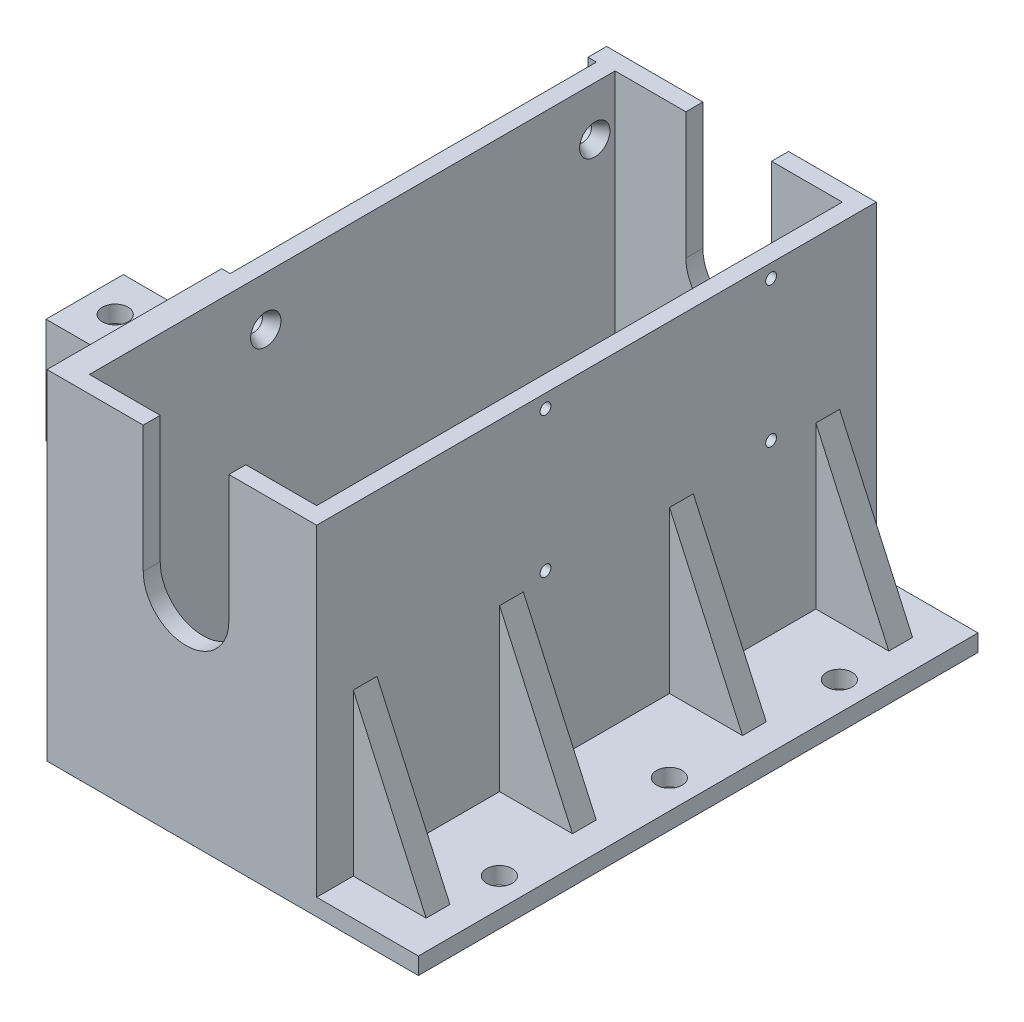
from build123d import *

# Parameters (mm, degrees)
SKETCH1_W           = 77
SKETCH1_H           = 165
BOSS_EXTRUDE2_DEPTH = 100
SKETCH4_W           = 67
SKETCH4_H           = 155
CUT_EXTRUDE1_DEPTH  = 95
SKETCH7_W           = 165
SKETCH7_H           = 100
BOSS_EXTRUDE4_DEPTH = 2.5
SKETCH5_W           = 108
SKETCH5_H           = 85
CUT_EXTRUDE2_DEPTH  = 2.5
CUT_EXTRUDE3_REACH  = 152.782
SKETCH9_R           = 2.475
CUT_EXTRUDE4_DEPTH  = 198.24603925
SKETCH11_W          = 165
SKETCH11_H          = 5
BOSS_EXTRUDE5_DEPTH = 30
SKETCH12_R          = 3.775
CUT_EXTRUDE5_DEPTH  = 144.260252687
RIB2_REACH          = 164.054
SKETCH17_WALL_W     = 378.24664849
SKETCH17_WALL_H     = 7
RIB3_REACH          = 195.398
SKETCH18_WALL_W     = 440.934996724
SKETCH18_WALL_H     = 7
RIB5_REACH          = 195.398
SKETCH20_WALL_W     = 440.934996724
SKETCH20_WALL_H     = 7
RIB6_REACH          = 164.054
SKETCH19_WALL_W     = 378.24664849
SKETCH19_WALL_H     = 7
SKETCH21_W          = 108
SKETCH21_H          = 15
BOSS_EXTRUDE6_DEPTH = 13
CUT_EXTRUDE6_REACH  = 168.056
SKETCH23_W          = 8
SKETCH23_H          = 10
SKETCH24_W          = 22.8
SKETCH24_H          = 31
BOSS_EXTRUDE7_DEPTH = 18
CHAMFER1_SIZE       = 2
CHAMFER1_SIZE2      = 3.464101615
CHAMFER2_SIZE       = 2
CHAMFER2_SIZE2      = 3.464101615
SKETCH25_W          = 9
SKETCH25_H          = 13.8
CUT_EXTRUDE7_DEPTH  = 26
CUT_EXTRUDE8_REACH  = 141.995
SKETCH26_R          = 3.775
CUT_EXTRUDE10_REACH = 164.211
SKETCH28_R          = 1.6
CHAMFER3_SIZE       = 2
CHAMFER4_SIZE       = 2
CHAMFER5_SIZE       = 2
CHAMFER6_SIZE       = 2
CUT_EXTRUDE11_REACH = 132.857
SKETCH29_W          = 13
SKETCH29_H          = 8.959672406


with BuildPart() as part:
    # Sketch1 → Boss-Extrude2 (new body)
    with BuildSketch(Plane(origin=(0, 0, 0), x_dir=(1, 0, 0), z_dir=(0, 1, 0))):
        Rectangle(SKETCH1_W, SKETCH1_H)
    extrude(amount=BOSS_EXTRUDE2_DEPTH)

    # Sketch4 → Cut-Extrude1 (cut)
    with BuildSketch(Plane(origin=(0, 100, 0), x_dir=(1, 0, 0), z_dir=(0, 1, 0))):
        Rectangle(SKETCH4_W, SKETCH4_H)
    extrude(amount=-CUT_EXTRUDE1_DEPTH, mode=Mode.SUBTRACT)

    # Sketch7 → Boss-Extrude4 (add)
    with BuildSketch(Plane.ZY.offset(38.5)):
        with Locations((0, 50)):
            Rectangle(SKETCH7_W, SKETCH7_H)
    extrude(amount=BOSS_EXTRUDE4_DEPTH)

    # Sketch5 → Cut-Extrude2 (cut)
    with BuildSketch(Plane.ZY.offset(38.5)):
        with Locations((-23, 85.5)):
            Rectangle(SKETCH5_W, SKETCH5_H)
    extrude(amount=CUT_EXTRUDE2_DEPTH, mode=Mode.SUBTRACT)

    # Sketch9 → Cut-Extrude3 (cut, up to next)
    with BuildSketch(Plane.ZY.offset(38.5), mode=Mode.PRIVATE) as cut_extrude3_sk1:
        with Locations((-71.5, 85.5)):
            Circle(SKETCH9_R)
    cut_extrude3_tool1 = extrude(cut_extrude3_sk1.sketch, amount=-CUT_EXTRUDE3_REACH, mode=Mode.PRIVATE) & part.part
    # Sketch9 → Cut-Extrude3 (cut, up to next)
    with BuildSketch(Plane.ZY.offset(38.5), mode=Mode.PRIVATE) as cut_extrude3_sk2:
        with Locations((25.5, 85.5)):
            Circle(SKETCH9_R)
    cut_extrude3_tool2 = extrude(cut_extrude3_sk2.sketch, amount=-CUT_EXTRUDE3_REACH, mode=Mode.PRIVATE) & part.part
    add(cut_extrude3_tool1.solids().sort_by_distance((-38.5, 85.5, -71.5))[0], mode=Mode.SUBTRACT)
    add(cut_extrude3_tool2.solids().sort_by_distance((-38.5, 85.5, 25.5))[0], mode=Mode.SUBTRACT)

    # Sketch10 → Cut-Extrude4 (cut, through all)
    with BuildSketch(Plane.XY.offset(82.5)):
        with BuildLine():
            Line((12.62916064, 100), (12.62916064, 62.639075144))
            ThreePointArc((12.62916064, 62.639075144), (0, 50.009914504), (-12.62916064, 62.639075144))
            Line((-12.62916064, 62.639075144), (-12.62916064, 100))
            ThreePointArc((-12.62916064, 100), (0, 112.62916064), (12.62916064, 100))
        make_face()
    extrude(amount=-CUT_EXTRUDE4_DEPTH, mode=Mode.SUBTRACT)

    # Sketch11 → Boss-Extrude5 (add)
    with BuildSketch(Plane(origin=(38.5, 0, 0), x_dir=(0, 0, -1), z_dir=(1, 0, 0))):
        with Locations((0, 2.5)):
            Rectangle(SKETCH11_W, SKETCH11_H)
    extrude(amount=BOSS_EXTRUDE5_DEPTH)

    # Sketch12 → Cut-Extrude5 (cut, through all)
    with BuildSketch(Plane(origin=(0, 5, 0), x_dir=(1, 0, 0), z_dir=(0, 1, 0))):
        with Locations((60, 50.12)):
            Circle(SKETCH12_R)
        with Locations((60, 0)):
            Circle(SKETCH12_R)
        with Locations((60, -50.12)):
            Circle(SKETCH12_R)
    extrude(amount=-CUT_EXTRUDE5_DEPTH, mode=Mode.SUBTRACT)

    # Sketch17 wall → Rib2 (add, up to next)
    with BuildSketch(Plane(origin=(49.25, 28.75, 25.06), x_dir=(-0.412357398674, 0.911022159861, 0), z_dir=(-0.911022159861, -0.412357398674, 0)), mode=Mode.PRIVATE) as rib2_sk1:
        Rectangle(SKETCH17_WALL_W, SKETCH17_WALL_H)
    rib2_tool1 = extrude(rib2_sk1.sketch, amount=RIB2_REACH, mode=Mode.PRIVATE) - part.part
    add(rib2_tool1.solids().sort_by_distance((49.25, 28.75, 25.06))[0])

    # Sketch18 wall → Rib3 (add, up to next)
    with BuildSketch(Plane(origin=(49.25, 28.75, 68.2), x_dir=(0.412357398674, -0.911022159861, 0), z_dir=(0.911022159861, 0.412357398674, 0)), mode=Mode.PRIVATE) as rib3_sk1:
        Rectangle(SKETCH18_WALL_W, SKETCH18_WALL_H)
    rib3_tool1 = extrude(rib3_sk1.sketch, amount=-RIB3_REACH, mode=Mode.PRIVATE) - part.part
    add(rib3_tool1.solids().sort_by_distance((49.25, 28.75, 68.2))[0])

    # Sketch20 wall → Rib5 (add, up to next)
    with BuildSketch(Plane(origin=(49.25, 28.75, -68.2), x_dir=(-0.412357398674, 0.911022159861, 0), z_dir=(-0.911022159861, -0.412357398674, 0)), mode=Mode.PRIVATE) as rib5_sk1:
        Rectangle(SKETCH20_WALL_W, SKETCH20_WALL_H)
    rib5_tool1 = extrude(rib5_sk1.sketch, amount=RIB5_REACH, mode=Mode.PRIVATE) - part.part
    add(rib5_tool1.solids().sort_by_distance((49.25, 28.75, -68.2))[0])

    # Sketch19 wall → Rib6 (add, up to next)
    with BuildSketch(Plane(origin=(49.25, 28.75, -25.06), x_dir=(-0.412357398674, 0.911022159861, 0), z_dir=(-0.911022159861, -0.412357398674, 0)), mode=Mode.PRIVATE) as rib6_sk1:
        Rectangle(SKETCH19_WALL_W, SKETCH19_WALL_H)
    rib6_tool1 = extrude(rib6_sk1.sketch, amount=RIB6_REACH, mode=Mode.PRIVATE) - part.part
    add(rib6_tool1.solids().sort_by_distance((49.25, 28.75, -25.06))[0])

    # Sketch21 → Boss-Extrude6 (add)
    with BuildSketch(Plane.ZY.offset(41)):
        with Locations((-23, 17.5)):
            Rectangle(SKETCH21_W, SKETCH21_H)
    extrude(amount=BOSS_EXTRUDE6_DEPTH)

    # Sketch23 → Cut-Extrude6 (cut, up to next)
    with BuildSketch(Plane.XY.offset(31), mode=Mode.PRIVATE) as cut_extrude6_sk1:
        with Locations((-45, 15)):
            Rectangle(SKETCH23_W, SKETCH23_H)
    cut_extrude6_tool1 = extrude(cut_extrude6_sk1.sketch, amount=-CUT_EXTRUDE6_REACH, mode=Mode.PRIVATE) & part.part
    add(cut_extrude6_tool1.solids().sort_by_distance((-45, 15, 31))[0], mode=Mode.SUBTRACT)

    # Sketch24 → Boss-Extrude7 (add)
    with BuildSketch(Plane.ZY.offset(41)):
        with Locations((53.4, 79.5)):
            Rectangle(SKETCH24_W, SKETCH24_H)
    extrude(amount=BOSS_EXTRUDE7_DEPTH)

    # Chamfer1
    chamfer1_edges = [part.edges().sort_by_distance(p)[0] for p in [
        (-33.5, 85.5, 23.025),
    ]]
    chamfer1_side = [part.faces().sort_by_distance(p)[0] for p in [
        (-33.5, 52.413518032, 0.060275311),
    ]]
    chamfer(chamfer1_edges, length=CHAMFER1_SIZE, length2=CHAMFER1_SIZE2, reference=chamfer1_side[0])

    # Chamfer2
    chamfer2_edges = [part.edges().sort_by_distance(p)[0] for p in [
        (-33.5, 85.5, -73.975),
    ]]
    chamfer2_side = [part.faces().sort_by_distance(p)[0] for p in [
        (-33.5, 52.31484696, -0.015591471),
    ]]
    chamfer(chamfer2_edges, length=CHAMFER2_SIZE, length2=CHAMFER2_SIZE2, reference=chamfer2_side[0])

    # Sketch25 → Cut-Extrude7 (cut)
    with BuildSketch(Plane.XZ.offset(-64)):
        with Locations((-50, 53.4)):
            Rectangle(SKETCH25_W, SKETCH25_H)
    extrude(amount=-CUT_EXTRUDE7_DEPTH, mode=Mode.SUBTRACT)

    # Sketch26 → Cut-Extrude8 (cut, up to next)
    with BuildSketch(Plane.XZ.offset(-90), mode=Mode.PRIVATE) as cut_extrude8_sk1:
        with Locations((-50, 53.4)):
            Circle(SKETCH26_R)
    cut_extrude8_tool1 = extrude(cut_extrude8_sk1.sketch, amount=-CUT_EXTRUDE8_REACH, mode=Mode.PRIVATE) & part.part
    add(cut_extrude8_tool1.solids().sort_by_distance((-50, 90, 53.4))[0], mode=Mode.SUBTRACT)

    # Sketch28 → Cut-Extrude10 (cut, up to next)
    with BuildSketch(Plane(origin=(38.5, 0, 0), x_dir=(0, 0, -1), z_dir=(1, 0, 0)), mode=Mode.PRIVATE) as cut_extrude10_sk1:
        with Locations((-15, 96)):
            Circle(SKETCH28_R)
    cut_extrude10_tool1 = extrude(cut_extrude10_sk1.sketch, amount=-CUT_EXTRUDE10_REACH, mode=Mode.PRIVATE) & part.part
    # Sketch28 → Cut-Extrude10 (cut, up to next)
    with BuildSketch(Plane(origin=(38.5, 0, 0), x_dir=(0, 0, -1), z_dir=(1, 0, 0)), mode=Mode.PRIVATE) as cut_extrude10_sk2:
        with Locations((-15, 54.648)):
            Circle(SKETCH28_R)
    cut_extrude10_tool2 = extrude(cut_extrude10_sk2.sketch, amount=-CUT_EXTRUDE10_REACH, mode=Mode.PRIVATE) & part.part
    # Sketch28 → Cut-Extrude10 (cut, up to next)
    with BuildSketch(Plane(origin=(38.5, 0, 0), x_dir=(0, 0, -1), z_dir=(1, 0, 0)), mode=Mode.PRIVATE) as cut_extrude10_sk3:
        with Locations((51.5, 96)):
            Circle(SKETCH28_R)
    cut_extrude10_tool3 = extrude(cut_extrude10_sk3.sketch, amount=-CUT_EXTRUDE10_REACH, mode=Mode.PRIVATE) & part.part
    # Sketch28 → Cut-Extrude10 (cut, up to next)
    with BuildSketch(Plane(origin=(38.5, 0, 0), x_dir=(0, 0, -1), z_dir=(1, 0, 0)), mode=Mode.PRIVATE) as cut_extrude10_sk4:
        with Locations((51.5, 54.648)):
            Circle(SKETCH28_R)
    cut_extrude10_tool4 = extrude(cut_extrude10_sk4.sketch, amount=-CUT_EXTRUDE10_REACH, mode=Mode.PRIVATE) & part.part
    add(cut_extrude10_tool1.solids().sort_by_distance((38.5, 96, 15))[0], mode=Mode.SUBTRACT)
    add(cut_extrude10_tool2.solids().sort_by_distance((38.5, 54.648, 15))[0], mode=Mode.SUBTRACT)
    add(cut_extrude10_tool3.solids().sort_by_distance((38.5, 96, -51.5))[0], mode=Mode.SUBTRACT)
    add(cut_extrude10_tool4.solids().sort_by_distance((38.5, 54.648, -51.5))[0], mode=Mode.SUBTRACT)

    # Chamfer3
    chamfer3_edges = [part.edges().sort_by_distance(p)[0] for p in [
        (33.5, 96, 16.6),
    ]]
    chamfer(chamfer3_edges, length=CHAMFER3_SIZE)

    # Chamfer4
    chamfer4_edges = [part.edges().sort_by_distance(p)[0] for p in [
        (33.5, 54.648, 16.6),
    ]]
    chamfer(chamfer4_edges, length=CHAMFER4_SIZE)

    # Chamfer5
    chamfer5_edges = [part.edges().sort_by_distance(p)[0] for p in [
        (33.5, 96, -49.9),
    ]]
    chamfer(chamfer5_edges, length=CHAMFER5_SIZE)

    # Chamfer6
    chamfer6_edges = [part.edges().sort_by_distance(p)[0] for p in [
        (33.5, 54.648, -49.9),
    ]]
    chamfer(chamfer6_edges, length=CHAMFER6_SIZE)

    # Sketch29 → Cut-Extrude11 (cut, up to next)
    with BuildSketch(Plane(origin=(0, 25, 0), x_dir=(1, 0, 0), z_dir=(0, 1, 0)), mode=Mode.PRIVATE) as cut_extrude11_sk1:
        with Locations((-47.5, 18.520163797)):
            Rectangle(SKETCH29_W, SKETCH29_H)
    cut_extrude11_tool1 = extrude(cut_extrude11_sk1.sketch, amount=-CUT_EXTRUDE11_REACH, mode=Mode.PRIVATE) & part.part
    add(cut_extrude11_tool1.solids().sort_by_distance((-47.5, 25, -18.520164))[0], mode=Mode.SUBTRACT)


solid = part.part
